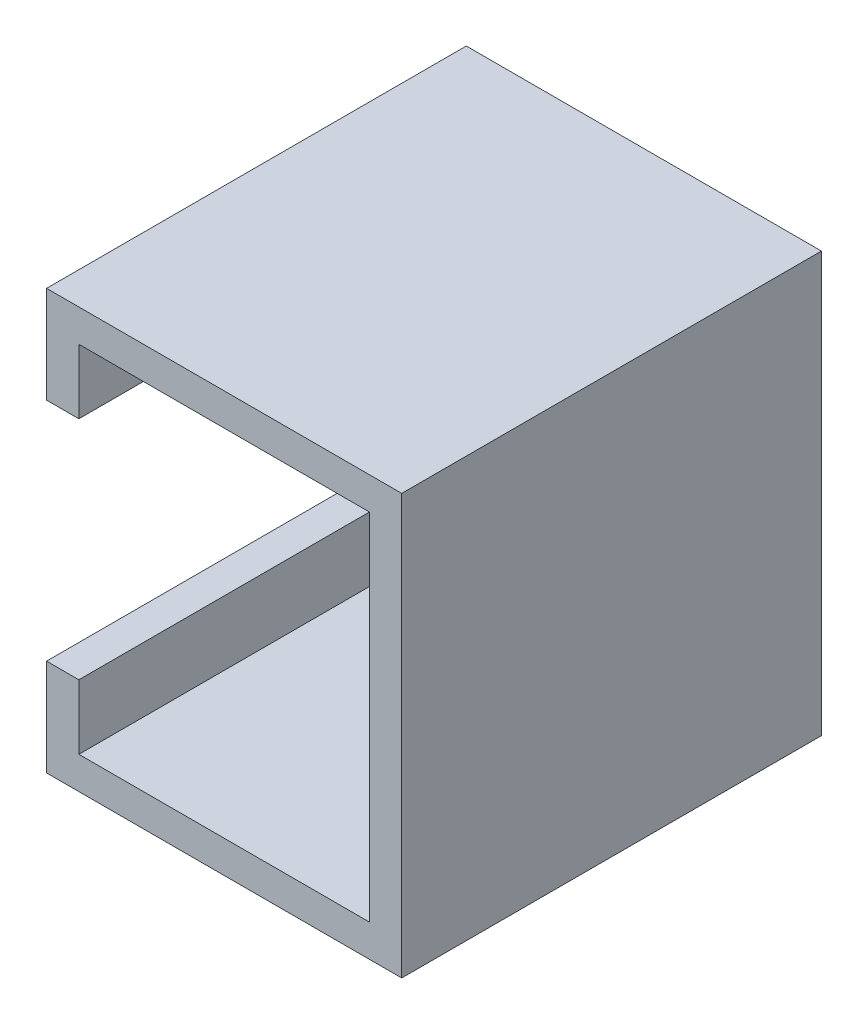
from build123d import *

# Parameters (mm, degrees)
SKIZZE1_W                       = 13
SKIZZE1_H                       = 13
AUFSATZ_LINEAR_AUSTRAGEN1_DEPTH = 11
WANDUNG1_T                      = -1
SKIZZE2_W                       = 1
SKIZZE2_H                       = 7
SCHNITT_LINEAR_AUSTRAGEN1_DEPTH = 12


with BuildPart() as part:
    # Skizze1 → Aufsatz-Linear austragen1 (new body)
    with BuildSketch(Plane(origin=(0, 0, 0), x_dir=(0, 0, -1), z_dir=(1, 0, 0))):
        with Locations((6.5, 6.5)):
            Rectangle(SKIZZE1_W, SKIZZE1_H)
    extrude(amount=AUFSATZ_LINEAR_AUSTRAGEN1_DEPTH)

    # Wandung1
    wandung1_openings = [part.faces().sort_by_distance(p)[0] for p in [
        (5.5, 6.5, 0),
    ]]
    offset(amount=WANDUNG1_T, openings=wandung1_openings, kind=Kind.INTERSECTION)

    # Skizze2 → Schnitt-Linear austragen1 (cut)
    with BuildSketch(Plane.XY):
        with Locations((0.5, 6.5)):
            Rectangle(SKIZZE2_W, SKIZZE2_H)
    extrude(amount=-SCHNITT_LINEAR_AUSTRAGEN1_DEPTH, mode=Mode.SUBTRACT)


solid = part.part
